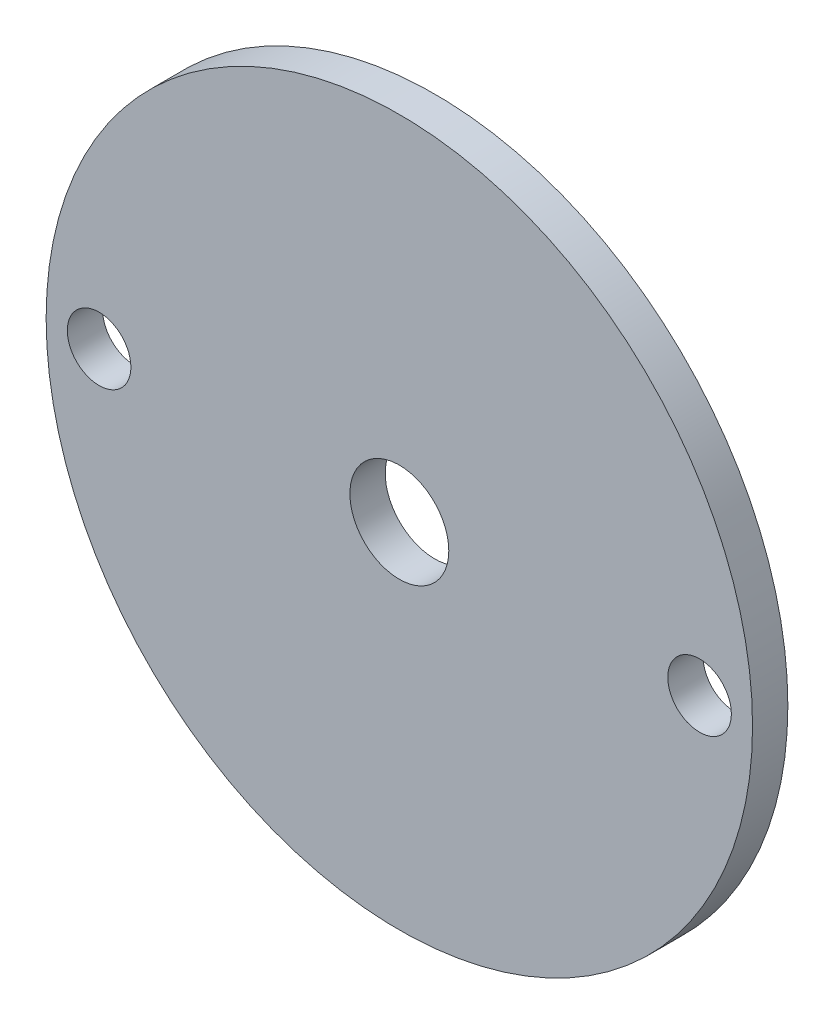
from build123d import *

# Parameters (mm, degrees)
SKETCH1_R           = 50
SKETCH1_R_2         = 7
BOSS_EXTRUDE1_DEPTH = 5
SKETCH2_R           = 4.5
CUT_EXTRUDE1_DEPTH  = 5


with BuildPart() as part:
    # Sketch1 → Boss-Extrude1 (new body)
    with BuildSketch(Plane.XY):
        Circle(SKETCH1_R)
        Circle(SKETCH1_R_2, mode=Mode.SUBTRACT)
    extrude(amount=BOSS_EXTRUDE1_DEPTH)

    # Sketch2 → Cut-Extrude1 (cut)
    with BuildSketch(Plane.XY.offset(5)):
        with Locations((-42.5, 0)):
            Circle(SKETCH2_R)
        with Locations((42.5, 0)):
            Circle(SKETCH2_R)
    extrude(amount=-CUT_EXTRUDE1_DEPTH, mode=Mode.SUBTRACT)


solid = part.part
